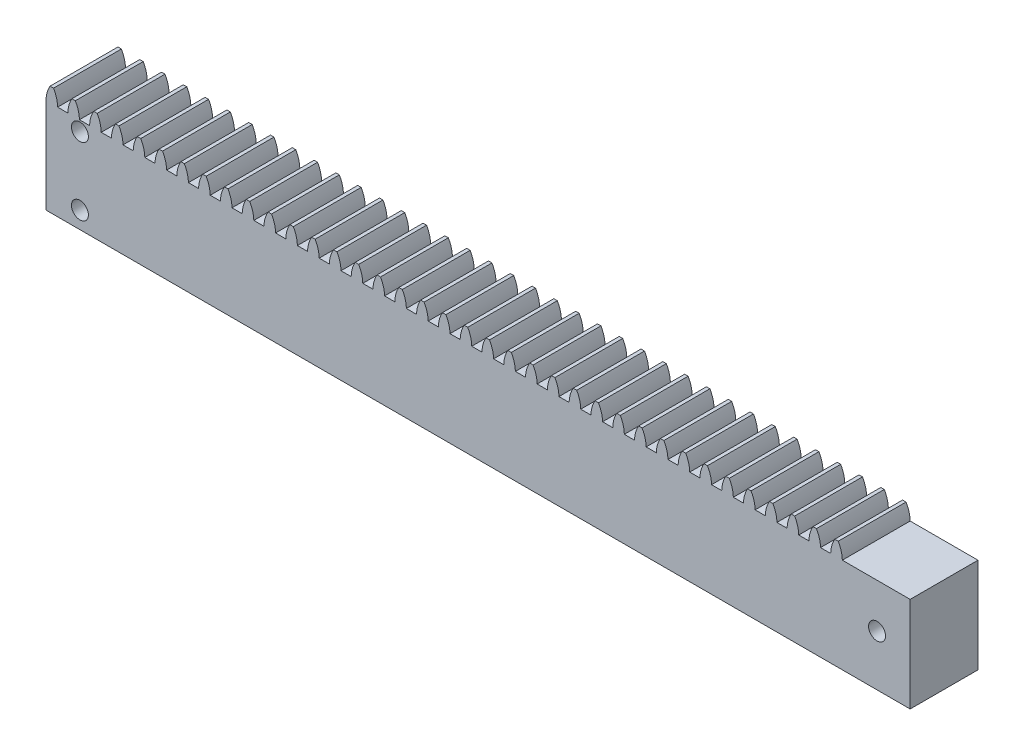
from build123d import *

# Parameters (mm, degrees)
EXTRUDE_3_DEPTH     = 10
SKETCH_3_R          = 1.25
CUT_EXTRUDE_1_DEPTH = 10


with BuildPart() as part:
    # 草圖2 → 填料-伸長3 (new body)
    with BuildSketch(Plane(origin=(-38.680131723, 0, 0), x_dir=(1, 0, 0), z_dir=(0, 0, 1))):
        with BuildLine():
            Line((1.049308304, 17.401478725), (1.562342658, 17.401478725))
            ThreePointArc((1.562342658, 17.401478725), (1.99609237, 16.376672717), (2.162564918, 15.276375913))
            Line((2.162564918, 15.276375913), (3.662120399, 15.276375913))
            ThreePointArc((3.662120399, 15.276375913), (3.828592947, 16.376672717), (4.262342658, 17.401478725))
            Line((4.262342658, 17.401478725), (4.775377012, 17.401478725))
            ThreePointArc((4.775377012, 17.401478725), (5.209126724, 16.376672717), (5.375599272, 15.276375913))
            Line((5.375599272, 15.276375913), (6.875154753, 15.276375913))
            ThreePointArc((6.875154753, 15.276375913), (7.041627301, 16.376672717), (7.475377012, 17.401478725))
            Line((7.475377012, 17.401478725), (7.988411366, 17.401478725))
            ThreePointArc((7.988411366, 17.401478725), (8.422161078, 16.376672717), (8.588633626, 15.276375913))
            Line((8.588633626, 15.276375913), (10.088189106, 15.276375913))
            ThreePointArc((10.088189106, 15.276375913), (10.254661655, 16.376672717), (10.688411366, 17.401478725))
            Line((10.688411366, 17.401478725), (11.20144572, 17.401478725))
            ThreePointArc((11.20144572, 17.401478725), (11.635195431, 16.376672717), (11.80166798, 15.276375913))
            Line((11.80166798, 15.276375913), (13.30122346, 15.276375913))
            ThreePointArc((13.30122346, 15.276375913), (13.467696009, 16.376672717), (13.90144572, 17.401478725))
            Line((13.90144572, 17.401478725), (14.414480074, 17.401478725))
            ThreePointArc((14.414480074, 17.401478725), (14.848229785, 16.376672717), (15.014702334, 15.276375913))
            Line((15.014702334, 15.276375913), (16.514257814, 15.276375913))
            ThreePointArc((16.514257814, 15.276375913), (16.680730363, 16.376672717), (17.114480074, 17.401478725))
            Line((17.114480074, 17.401478725), (17.627514428, 17.401478725))
            ThreePointArc((17.627514428, 17.401478725), (18.061264139, 16.376672717), (18.227736688, 15.276375913))
            Line((18.227736688, 15.276375913), (19.727292168, 15.276375913))
            ThreePointArc((19.727292168, 15.276375913), (19.893764716, 16.376672717), (20.327514428, 17.401478725))
            Line((20.327514428, 17.401478725), (20.840548782, 17.401478725))
            ThreePointArc((20.840548782, 17.401478725), (21.274298493, 16.376672717), (21.440771041, 15.276375913))
            Line((21.440771041, 15.276375913), (22.940326522, 15.276375913))
            ThreePointArc((22.940326522, 15.276375913), (23.10679907, 16.376672717), (23.540548782, 17.401478725))
            Line((23.540548782, 17.401478725), (24.053583136, 17.401478725))
            ThreePointArc((24.053583136, 17.401478725), (24.487332847, 16.376672717), (24.653805395, 15.276375913))
            Line((24.653805395, 15.276375913), (26.153360876, 15.276375913))
            ThreePointArc((26.153360876, 15.276375913), (26.319833424, 16.376672717), (26.753583136, 17.401478725))
            Line((26.753583136, 17.401478725), (27.26661749, 17.401478725))
            ThreePointArc((27.26661749, 17.401478725), (27.700367201, 16.376672717), (27.866839749, 15.276375913))
            Line((27.866839749, 15.276375913), (29.36639523, 15.276375913))
            ThreePointArc((29.36639523, 15.276375913), (29.532867778, 16.376672717), (29.96661749, 17.401478725))
            Line((29.96661749, 17.401478725), (30.479651843, 17.401478725))
            ThreePointArc((30.479651843, 17.401478725), (30.913401555, 16.376672717), (31.079874103, 15.276375913))
            Line((31.079874103, 15.276375913), (32.579429584, 15.276375913))
            ThreePointArc((32.579429584, 15.276375913), (32.745902132, 16.376672717), (33.179651843, 17.401478725))
            Line((33.179651843, 17.401478725), (33.692686197, 17.401478725))
            ThreePointArc((33.692686197, 17.401478725), (34.126435909, 16.376672717), (34.292908457, 15.276375913))
            Line((34.292908457, 15.276375913), (35.792463938, 15.276375913))
            ThreePointArc((35.792463938, 15.276375913), (35.958936486, 16.376672717), (36.392686197, 17.401478725))
            Line((36.392686197, 17.401478725), (36.905720551, 17.401478725))
            ThreePointArc((36.905720551, 17.401478725), (37.339470263, 16.376672717), (37.505942811, 15.276375913))
            Line((37.505942811, 15.276375913), (39.005498292, 15.276375913))
            ThreePointArc((39.005498292, 15.276375913), (39.17197084, 16.376672717), (39.605720551, 17.401478725))
            Line((39.605720551, 17.401478725), (40.118754905, 17.401478725))
            ThreePointArc((40.118754905, 17.401478725), (40.552504617, 16.376672717), (40.718977165, 15.276375913))
            Line((40.718977165, 15.276375913), (42.218532645, 15.276375913))
            ThreePointArc((42.218532645, 15.276375913), (42.385005194, 16.376672717), (42.818754905, 17.401478725))
            Line((42.818754905, 17.401478725), (43.331789259, 17.401478725))
            ThreePointArc((43.331789259, 17.401478725), (43.76553897, 16.376672717), (43.932011519, 15.276375913))
            Line((43.932011519, 15.276375913), (45.431566999, 15.276375913))
            ThreePointArc((45.431566999, 15.276375913), (45.598039548, 16.376672717), (46.031789259, 17.401478725))
            Line((46.031789259, 17.401478725), (46.544823613, 17.401478725))
            ThreePointArc((46.544823613, 17.401478725), (46.978573324, 16.376672717), (47.145045873, 15.276375913))
            Line((47.145045873, 15.276375913), (48.644601353, 15.276375913))
            ThreePointArc((48.644601353, 15.276375913), (48.811073902, 16.376672717), (49.244823613, 17.401478725))
            Line((49.244823613, 17.401478725), (49.757857967, 17.401478725))
            ThreePointArc((49.757857967, 17.401478725), (50.191607678, 16.376672717), (50.358080227, 15.276375913))
            Line((50.358080227, 15.276375913), (51.857635707, 15.276375913))
            ThreePointArc((51.857635707, 15.276375913), (52.024108255, 16.376672717), (52.457857967, 17.401478725))
            Line((52.457857967, 17.401478725), (52.970892321, 17.401478725))
            ThreePointArc((52.970892321, 17.401478725), (53.404642032, 16.376672717), (53.57111458, 15.276375913))
            Line((53.57111458, 15.276375913), (55.070670061, 15.276375913))
            ThreePointArc((55.070670061, 15.276375913), (55.237142609, 16.376672717), (55.670892321, 17.401478725))
            Line((55.670892321, 17.401478725), (56.183926675, 17.401478725))
            ThreePointArc((56.183926675, 17.401478725), (56.617676386, 16.376672717), (56.784148934, 15.276375913))
            Line((56.784148934, 15.276375913), (58.283704415, 15.276375913))
            ThreePointArc((58.283704415, 15.276375913), (58.450176963, 16.376672717), (58.883926675, 17.401478725))
            Line((58.883926675, 17.401478725), (59.396961029, 17.401478725))
            ThreePointArc((59.396961029, 17.401478725), (59.83071074, 16.376672717), (59.997183288, 15.276375913))
            Line((59.997183288, 15.276375913), (61.496738769, 15.276375913))
            ThreePointArc((61.496738769, 15.276375913), (61.663211317, 16.376672717), (62.096961029, 17.401478725))
            Line((62.096961029, 17.401478725), (62.609995382, 17.401478725))
            ThreePointArc((62.609995382, 17.401478725), (63.043745094, 16.376672717), (63.210217642, 15.276375913))
            Line((63.210217642, 15.276375913), (64.709773123, 15.276375913))
            ThreePointArc((64.709773123, 15.276375913), (64.876245671, 16.376672717), (65.309995382, 17.401478725))
            Line((65.309995382, 17.401478725), (65.823029736, 17.401478725))
            ThreePointArc((65.823029736, 17.401478725), (66.256779448, 16.376672717), (66.423251996, 15.276375913))
            Line((66.423251996, 15.276375913), (67.922807477, 15.276375913))
            ThreePointArc((67.922807477, 15.276375913), (68.089280025, 16.376672717), (68.523029736, 17.401478725))
            Line((68.523029736, 17.401478725), (69.03606409, 17.401478725))
            ThreePointArc((69.03606409, 17.401478725), (69.469813802, 16.376672717), (69.63628635, 15.276375913))
            Line((69.63628635, 15.276375913), (71.135841831, 15.276375913))
            ThreePointArc((71.135841831, 15.276375913), (71.302314379, 16.376672717), (71.73606409, 17.401478725))
            Line((71.73606409, 17.401478725), (72.249098444, 17.401478725))
            ThreePointArc((72.249098444, 17.401478725), (72.682848156, 16.376672717), (72.849320704, 15.276375913))
            Line((72.849320704, 15.276375913), (74.348876184, 15.276375913))
            ThreePointArc((74.348876184, 15.276375913), (74.515348733, 16.376672717), (74.949098444, 17.401478725))
            Line((74.949098444, 17.401478725), (75.462132798, 17.401478725))
            ThreePointArc((75.462132798, 17.401478725), (75.895882509, 16.376672717), (76.062355058, 15.276375913))
            Line((76.062355058, 15.276375913), (77.561910538, 15.276375913))
            ThreePointArc((77.561910538, 15.276375913), (77.728383087, 16.376672717), (78.162132798, 17.401478725))
            Line((78.162132798, 17.401478725), (78.675167152, 17.401478725))
            ThreePointArc((78.675167152, 17.401478725), (79.108916863, 16.376672717), (79.275389412, 15.276375913))
            Line((79.275389412, 15.276375913), (80.774944892, 15.276375913))
            ThreePointArc((80.774944892, 15.276375913), (80.941417441, 16.376672717), (81.375167152, 17.401478725))
            Line((81.375167152, 17.401478725), (81.888201506, 17.401478725))
            ThreePointArc((81.888201506, 17.401478725), (82.321951217, 16.376672717), (82.488423766, 15.276375913))
            Line((82.488423766, 15.276375913), (83.987979246, 15.276375913))
            ThreePointArc((83.987979246, 15.276375913), (84.154451795, 16.376672717), (84.588201506, 17.401478725))
            Line((84.588201506, 17.401478725), (85.10123586, 17.401478725))
            ThreePointArc((85.10123586, 17.401478725), (85.534985571, 16.376672717), (85.70145812, 15.276375913))
            Line((85.70145812, 15.276375913), (87.2010136, 15.276375913))
            ThreePointArc((87.2010136, 15.276375913), (87.367486148, 16.376672717), (87.80123586, 17.401478725))
            Line((87.80123586, 17.401478725), (88.314270214, 17.401478725))
            ThreePointArc((88.314270214, 17.401478725), (88.748019925, 16.376672717), (88.914492473, 15.276375913))
            Line((88.914492473, 15.276375913), (90.414047954, 15.276375913))
            ThreePointArc((90.414047954, 15.276375913), (90.580520502, 16.376672717), (91.014270214, 17.401478725))
            Line((91.014270214, 17.401478725), (91.527304568, 17.401478725))
            ThreePointArc((91.527304568, 17.401478725), (91.961054279, 16.376672717), (92.127526827, 15.276375913))
            Line((92.127526827, 15.276375913), (93.627082308, 15.276375913))
            ThreePointArc((93.627082308, 15.276375913), (93.793554856, 16.376672717), (94.227304568, 17.401478725))
            Line((94.227304568, 17.401478725), (94.740338921, 17.401478725))
            ThreePointArc((94.740338921, 17.401478725), (95.174088633, 16.376672717), (95.340561181, 15.276375913))
            Line((95.340561181, 15.276375913), (96.840116662, 15.276375913))
            ThreePointArc((96.840116662, 15.276375913), (97.00658921, 16.376672717), (97.440338921, 17.401478725))
            Line((97.440338921, 17.401478725), (97.953373275, 17.401478725))
            ThreePointArc((97.953373275, 17.401478725), (98.387122987, 16.376672717), (98.553595535, 15.276375913))
            Line((98.553595535, 15.276375913), (100.053151016, 15.276375913))
            ThreePointArc((100.053151016, 15.276375913), (100.219623564, 16.376672717), (100.653373275, 17.401478725))
            Line((100.653373275, 17.401478725), (101.166407629, 17.401478725))
            ThreePointArc((101.166407629, 17.401478725), (101.600157341, 16.376672717), (101.766629889, 15.276375913))
            Line((101.766629889, 15.276375913), (103.26618537, 15.276375913))
            ThreePointArc((103.26618537, 15.276375913), (103.432657918, 16.376672717), (103.866407629, 17.401478725))
            Line((103.866407629, 17.401478725), (104.379441983, 17.401478725))
            ThreePointArc((104.379441983, 17.401478725), (104.813191695, 16.376672717), (104.979664243, 15.276375913))
            Line((104.979664243, 15.276375913), (106.479219723, 15.276375913))
            ThreePointArc((106.479219723, 15.276375913), (106.645692272, 16.376672717), (107.079441983, 17.401478725))
            Line((107.079441983, 17.401478725), (107.592476337, 17.401478725))
            ThreePointArc((107.592476337, 17.401478725), (108.026226048, 16.376672717), (108.192698597, 15.276375913))
            Line((108.192698597, 15.276375913), (109.692254077, 15.276375913))
            ThreePointArc((109.692254077, 15.276375913), (109.858726626, 16.376672717), (110.292476337, 17.401478725))
            Line((110.292476337, 17.401478725), (110.805510691, 17.401478725))
            ThreePointArc((110.805510691, 17.401478725), (111.239260402, 16.376672717), (111.405732951, 15.276375913))
            Line((111.405732951, 15.276375913), (112.905288431, 15.276375913))
            ThreePointArc((112.905288431, 15.276375913), (113.07176098, 16.376672717), (113.505510691, 17.401478725))
            Line((113.505510691, 17.401478725), (114.018545045, 17.401478725))
            ThreePointArc((114.018545045, 17.401478725), (114.452294756, 16.376672717), (114.618767305, 15.276375913))
            Line((114.618767305, 15.276375913), (116.118322785, 15.276375913))
            ThreePointArc((116.118322785, 15.276375913), (116.284795334, 16.376672717), (116.718545045, 17.401478725))
            Line((116.718545045, 17.401478725), (117.231579399, 17.401478725))
            ThreePointArc((117.231579399, 17.401478725), (117.66532911, 16.376672717), (117.831801659, 15.276375913))
            Line((117.831801659, 15.276375913), (127.831801659, 15.276375913))
            Line((127.831801659, 15.276375913), (127.831801659, 1.276375913))
            Line((127.831801659, 1.276375913), (0.449086045, 1.276375913))
            Line((0.449086045, 1.276375913), (0.449086045, 15.276375913))
            ThreePointArc((0.449086045, 15.276375913), (0.615558593, 16.376672717), (1.049308304, 17.401478725))
        make_face()
    extrude(amount=EXTRUDE_3_DEPTH)

    # 草圖3 → 除料-伸長1 (cut)
    with BuildSketch(Plane.XY.offset(10)):
        with Locations((-33.231045679, 13.776375913)):
            Circle(SKETCH_3_R)
        with Locations((-33.231045679, 3.776375913)):
            Circle(SKETCH_3_R)
        with Locations((84.268954321, 8.776375913)):
            Circle(SKETCH_3_R)
    extrude(amount=-CUT_EXTRUDE_1_DEPTH, mode=Mode.SUBTRACT)


solid = part.part
